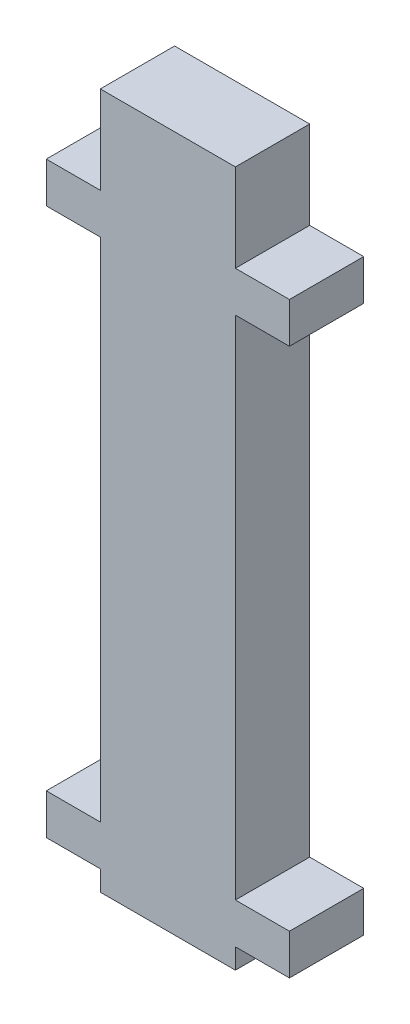
from build123d import *

# Parameters (mm, degrees)
BOSS_EXTRU_1_DEPTH = 11


with BuildPart() as part:
    # Esquisse1 → Boss.-Extru.1 (new body)
    with BuildSketch(Plane.XY):
        Polygon((0, 81), (0, 6), (-8, 6), (-8, 0), (0, 0), (0, -3), (20, -3), (20, 0), (28, 0), (28, 6), (20, 6), (20, 81), (28, 81), (28, 87), (20, 87), (20, 100), (15, 100), (5, 100), (0, 100), (0, 87), (-8, 87), (-8, 81), align=None)
    extrude(amount=BOSS_EXTRU_1_DEPTH)


solid = part.part
